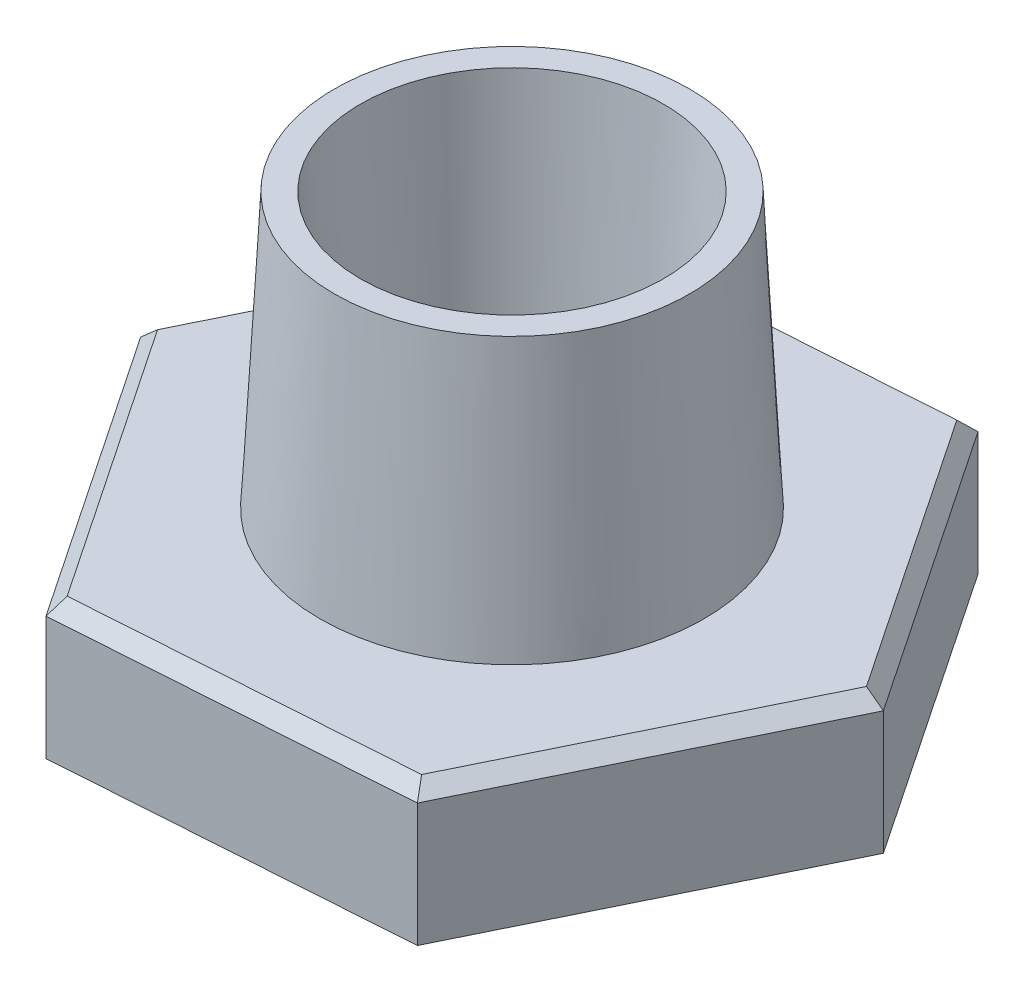
from build123d import *

# Parameters (mm, degrees)
SKETCH1_R           = 5
BOSS_EXTRUDE1_DEPTH = 5
CHAMFER1_SIZE       = 0.5
SKETCH2_R           = 7
SKETCH2_R_2         = 5
BOSS_EXTRUDE2_DEPTH = 10
BOSS_EXTRUDE2_DRAFT = 3


with BuildPart() as part:
    # Sketch1 → Boss-Extrude1 (new body)
    with BuildSketch(Plane(origin=(0, 0, 0), x_dir=(1, 0, 0), z_dir=(0, 1, 0))):
        Polygon((7.08862867, -10.539671575), (12.671937667, 0.869096719), (5.583308997, 11.408768294), (-7.08862867, 10.539671575), (-12.671937667, -0.869096719), (-5.583308997, -11.408768294), align=None)
        with Locations(Location((0, 0, 0), (0, 0, 270))):
            Circle(SKETCH1_R, mode=Mode.SUBTRACT)
    extrude(amount=BOSS_EXTRUDE1_DEPTH)

    # Chamfer1
    chamfer1_edges = [part.edges().sort_by_distance(p)[0] for p in [
        (9.127623332, 5, -6.138932506),
        (-0.752659837, 5, -10.974219934),
        (-9.880283168, 5, -4.835287428),
        (-9.127623332, 5, 6.138932506),
        (0.752659837, 5, 10.974219934),
        (9.880283168, 5, 4.835287428),
    ]]
    chamfer(chamfer1_edges, length=CHAMFER1_SIZE)


with BuildPart() as boss_extrude2_tool:
    # Sketch2 → Boss-Extrude2 (with draft: the straight prism first)
    with BuildSketch(Plane(origin=(0, 5, 0), x_dir=(1, 0, 0), z_dir=(0, 1, 0))):
        Circle(SKETCH2_R)
        with Locations(Location((0, 0, 0), (0, 0, 270))):
            Circle(SKETCH2_R_2, mode=Mode.SUBTRACT)
    extrude(amount=BOSS_EXTRUDE2_DEPTH)
    # Boss-Extrude2: the draft: its side faces are tilted about the plane it starts from
    boss_extrude2_sides = [boss_extrude2_tool.faces().sort_by_distance(p)[0] for p in [
        (-7, 10, 0),
        (0, 10, -5),
    ]]
    draft(boss_extrude2_sides, Plane(origin=(0, 5, 0), x_dir=(1, 0, 0), z_dir=(0, 1, 0)), BOSS_EXTRUDE2_DRAFT)


with BuildPart() as part_1:
    add(part.part)

    # Boss-Extrude2: add boss_extrude2_tool
    add(boss_extrude2_tool.part)


solid = part_1.part
